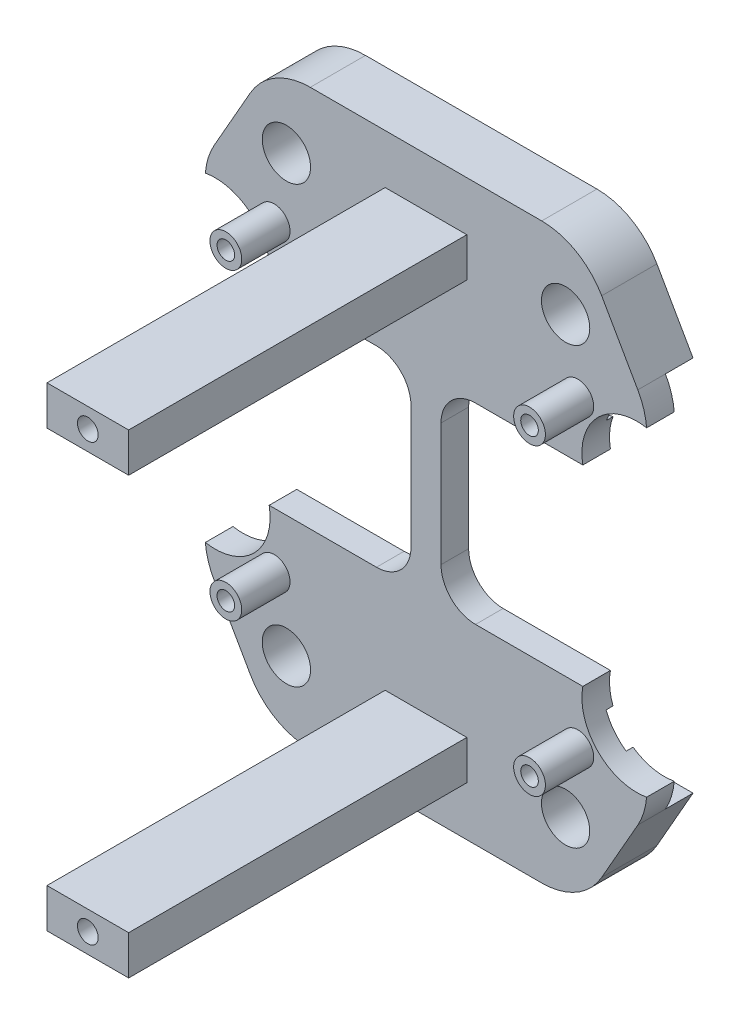
from build123d import *

# Parameters (mm, degrees)
IZIM1_R                     = 1.5
IZIM1_R_2                   = 1.275
Y_KSEKLIK_EKSTR_ZYON1_DEPTH = 8
IZIM2_R                     = 4
KES_EKSTR_ZYON1_DEPTH       = 5
IZIM3_R                     = 3.5
KES_EKSTR_ZYON2_DEPTH       = 5
IZIM5_W                     = 11.833700998
IZIM5_H                     = 5.687133077
Y_KSEKLIK_EKSTR_ZYON2_DEPTH = 49
IZIM6_R                     = 1.5
KES_EKSTR_ZYON3_DEPTH       = 70
IZIM7_R                     = 7.94785764
KES_EKSTR_ZYON4_DEPTH       = 94.5
IZIM8_R                     = 2.303053837
IZIM8_R_2                   = 1.275
Y_KSEKLIK_EKSTR_ZYON3_DEPTH = 7
IZIM9_W                     = 9.184473095
IZIM9_H                     = 54.60219781
KES_EKSTR_ZYON5_DEPTH       = 49


with BuildPart() as part:
    # Çizim1 → Yükseklik-Ekstrüzyon1 (new body)
    with BuildSketch(Plane.XY):
        with BuildLine():
            Line((-26.942326891, 14.769848309), (-7.118223783, 14.769848309))
            ThreePointArc((-7.118223783, 14.769848309), (-3.582689877, 13.305382214), (-2.118223783, 9.769848309))
            Line((-2.118223783, 9.769848309), (-2.118223783, -8.006371062))
            ThreePointArc((-2.118223783, -8.006371062), (-3.582689877, -11.541904968), (-7.118223783, -13.006371062))
            Line((-7.118223783, -13.006371062), (-26.942326891, -13.006371062))
            ThreePointArc((-26.942326891, -13.006371062), (-30.477860797, -14.470837156), (-31.942326891, -18.006371062))
            Line((-31.942326891, -18.006371062), (-31.942326891, -21.470074229))
            ThreePointArc((-31.942326891, -21.470074229), (-31.6091093, -24.030019123), (-30.63166332, -26.419360282))
            Line((-30.63166332, -26.419360282), (-25.398075072, -35.607838889))
            ThreePointArc((-25.398075072, -35.607838889), (-21.734031643, -39.304154624), (-16.708738643, -40.658552836))
            Line((-16.708738643, -40.658552836), (16.824084861, -40.658552836))
            ThreePointArc((16.824084861, -40.658552836), (21.849377861, -39.304154624), (25.513421289, -35.607838889))
            Line((25.513421289, -35.607838889), (30.747009537, -26.419360282))
            ThreePointArc((30.747009537, -26.419360282), (31.724455518, -24.030019123), (32.057673109, -21.470074229))
            Line((32.057673109, -21.470074229), (32.057673109, -18.006371062))
            ThreePointArc((32.057673109, -18.006371062), (30.593207015, -14.470837156), (27.057673109, -13.006371062))
            Line((27.057673109, -13.006371062), (7.233570001, -13.006371062))
            ThreePointArc((7.233570001, -13.006371062), (3.698036095, -11.541904968), (2.233570001, -8.006371062))
            Line((2.233570001, -8.006371062), (2.233570001, 9.769848309))
            ThreePointArc((2.233570001, 9.769848309), (3.698036095, 13.305382214), (7.233570001, 14.769848309))
            Line((7.233570001, 14.769848309), (27.057673109, 14.769848309))
            ThreePointArc((27.057673109, 14.769848309), (30.593207015, 16.234314403), (32.057673109, 19.769848309))
            Line((32.057673109, 19.769848309), (32.057673109, 23.233551476))
            ThreePointArc((32.057673109, 23.233551476), (31.724455518, 25.793496369), (30.747009537, 28.182837528))
            Line((30.747009537, 28.182837528), (25.513421289, 37.371316135))
            ThreePointArc((25.513421289, 37.371316135), (21.849377861, 41.06763187), (16.824084861, 42.422030083))
            Line((16.824084861, 42.422030083), (-16.708738643, 42.422030083))
            ThreePointArc((-16.708738643, 42.422030083), (-21.734031643, 41.06763187), (-25.398075072, 37.371316135))
            Line((-25.398075072, 37.371316135), (-30.63166332, 28.182837528))
            ThreePointArc((-30.63166332, 28.182837528), (-31.6091093, 25.793496369), (-31.942326891, 23.233551476))
            Line((-31.942326891, 23.233551476), (-31.942326891, 19.769848309))
            ThreePointArc((-31.942326891, 19.769848309), (-30.477860797, 16.234314403), (-26.942326891, 14.769848309))
        make_face()
        with Locations((20.284256069, 32.422030083)):
            Circle(IZIM1_R, mode=Mode.SUBTRACT)
        with Locations((-20.168909852, 32.422030083)):
            Circle(IZIM1_R, mode=Mode.SUBTRACT)
        with Locations((-20.168909852, -30.658552836)):
            Circle(IZIM1_R, mode=Mode.SUBTRACT)
        with Locations((20.284256069, -30.658552836)):
            Circle(IZIM1_R, mode=Mode.SUBTRACT)
        with Locations((22.057673109, -21.118261377)):
            Circle(IZIM1_R_2, mode=Mode.SUBTRACT)
        with Locations((-21.942326891, -21.118261377)):
            Circle(IZIM1_R_2, mode=Mode.SUBTRACT)
        with Locations((22.057673109, 22.881738623)):
            Circle(IZIM1_R_2, mode=Mode.SUBTRACT)
        with Locations((-21.942326891, 22.881738623)):
            Circle(IZIM1_R_2, mode=Mode.SUBTRACT)
        with Locations((0.057673109, 32.422030083)):
            Circle(IZIM1_R, mode=Mode.SUBTRACT)
        with Locations(Location((0.057673109, -30.658552836, 0), (0, 0, 180))):
            Circle(IZIM1_R, mode=Mode.SUBTRACT)
    extrude(amount=Y_KSEKLIK_EKSTR_ZYON1_DEPTH)

    # Çizim2 → Kes-Ekstrüzyon1 (cut)
    with BuildSketch(Plane(origin=(0, 0, 0), x_dir=(-1, 0, 0), z_dir=(0, 0, -1))):
        with Locations((-22.057673109, 22.881738623)):
            Circle(IZIM2_R)
        with Locations((21.942326891, 22.881738623)):
            Circle(IZIM2_R)
        with Locations((-22.057673109, -21.118261377)):
            Circle(IZIM2_R)
        with Locations((21.942326891, -21.118261377)):
            Circle(IZIM2_R)
        with Locations((-0.057673109, 32.422030083)):
            Circle(IZIM2_R)
        with Locations((-0.057673109, -30.658552836)):
            Circle(IZIM2_R)
    extrude(amount=-KES_EKSTR_ZYON1_DEPTH, mode=Mode.SUBTRACT)

    # Çizim3 → Kes-Ekstrüzyon2 (cut)
    with BuildSketch(Plane.XY.offset(8)):
        with Locations((-20.168909852, 32.422030083)):
            Circle(IZIM3_R)
        with Locations((20.284256069, 32.422030083)):
            Circle(IZIM3_R)
        with Locations((20.284256069, -30.658552836)):
            Circle(IZIM3_R)
        with Locations((-20.168909852, -30.658552836)):
            Circle(IZIM3_R)
    extrude(amount=-KES_EKSTR_ZYON2_DEPTH, mode=Mode.SUBTRACT)

    # Çizim5 → Yükseklik-Ekstrüzyon2 (add)
    with BuildSketch(Plane.XY.offset(8)):
        with Locations((0.057673109, 32.422030083)):
            Rectangle(IZIM5_W, IZIM5_H)
        with Locations((0.057673109, -30.658552837)):
            Rectangle(IZIM5_W, IZIM5_H)
    extrude(amount=Y_KSEKLIK_EKSTR_ZYON2_DEPTH)

    # Çizim6 → Kes-Ekstrüzyon3 (cut)
    with BuildSketch(Plane(origin=(0, 0, 8), x_dir=(-1, 0, 0), z_dir=(0, 0, -1))):
        with Locations((-0.057673109, -30.658552836)):
            Circle(IZIM6_R)
        with Locations((-0.057673109, 32.422030083)):
            Circle(IZIM6_R)
    extrude(amount=-KES_EKSTR_ZYON3_DEPTH, mode=Mode.SUBTRACT)

    # Çizim7 → Kes-Ekstrüzyon4 (cut, symmetric)
    with BuildSketch(Plane.XY.offset(8)):
        with Locations((30.593207015, 16.234314403)):
            Circle(IZIM7_R)
        with Locations((-30.477860797, 16.234314403)):
            Circle(IZIM7_R)
        with Locations((30.593207015, -14.470837156)):
            Circle(IZIM7_R)
        with Locations((-30.477860797, -14.470837156)):
            Circle(IZIM7_R)
    extrude(amount=KES_EKSTR_ZYON4_DEPTH, both=True, mode=Mode.SUBTRACT)

    # Çizim8 → Yükseklik-Ekstrüzyon3 (add)
    # profile 1 of 4: a face of its own
    with BuildSketch(Plane.XY.offset(8)):
        with Locations((-21.942326891, 22.881738623)):
            Circle(IZIM8_R)
        with Locations(Location((-21.942326891, 22.881738623, 0), (0, 0, 180))):
            Circle(IZIM8_R_2, mode=Mode.SUBTRACT)
    # profile 2 of 4: a face of its own
    with BuildSketch(Plane.XY.offset(8)):
        with Locations((22.057673109, 22.881738623)):
            Circle(IZIM8_R)
        with Locations(Location((22.057673109, 22.881738623, 0), (0, 0, 180))):
            Circle(IZIM8_R_2, mode=Mode.SUBTRACT)
    # profile 3 of 4: a face of its own
    with BuildSketch(Plane.XY.offset(8)):
        with Locations((-21.942326891, -21.118261377)):
            Circle(IZIM8_R)
        with Locations(Location((-21.942326891, -21.118261377, 0), (0, 0, 180))):
            Circle(IZIM8_R_2, mode=Mode.SUBTRACT)
    # profile 4 of 4: a face of its own
    with BuildSketch(Plane.XY.offset(8)):
        with Locations((22.057673109, -21.118261377)):
            Circle(IZIM8_R)
        with Locations(Location((22.057673109, -21.118261377, 0), (0, 0, 180))):
            Circle(IZIM8_R_2, mode=Mode.SUBTRACT)
    extrude(amount=Y_KSEKLIK_EKSTR_ZYON3_DEPTH)

    # Çizim9 → Kes-Ekstrüzyon5 (cut, symmetric)
    with BuildSketch(Plane(origin=(2.233570001, 0, 0), x_dir=(0, 0, -1), z_dir=(1, 0, 0))):
        with Locations((0.592236548, 0.881738623)):
            Rectangle(IZIM9_W, IZIM9_H)
    extrude(amount=KES_EKSTR_ZYON5_DEPTH, both=True, mode=Mode.SUBTRACT)


solid = part.part
